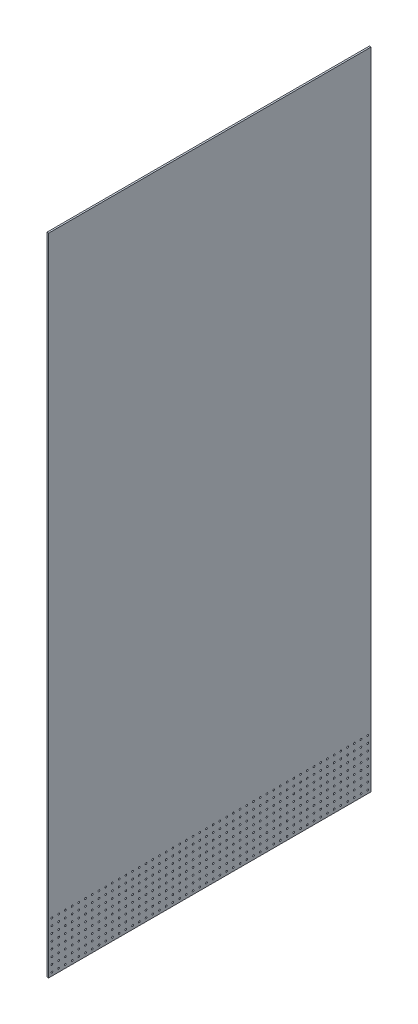
from build123d import *

# Parameters (mm, degrees)
INITIAL_HOLE_W      = 2438.4
INITIAL_HOLE_H      = 1219.2
INITIAL_HOLE_R      = 3.175
BOSS_EXTRUDE1_DEPTH = 6.35


with BuildPart() as part:
    # Initial hole → Boss-Extrude1 (new body)
    with BuildSketch(Plane.YZ):
        Rectangle(INITIAL_HOLE_W, INITIAL_HOLE_H)
        with Locations(Location((-1206.5, 596.9, 0), (0, 0, 270))):
            Circle(INITIAL_HOLE_R, mode=Mode.SUBTRACT)
        with Locations(Location((-1181.1, 596.9, 0), (0, 0, 270))):
            Circle(INITIAL_HOLE_R, mode=Mode.SUBTRACT)
        with Locations(Location((-1155.7, 596.9, 0), (0, 0, 270))):
            Circle(INITIAL_HOLE_R, mode=Mode.SUBTRACT)
        with Locations(Location((-1130.3, 596.9, 0), (0, 0, 270))):
            Circle(INITIAL_HOLE_R, mode=Mode.SUBTRACT)
        with Locations(Location((-1104.9, 596.9, 0), (0, 0, 270))):
            Circle(INITIAL_HOLE_R, mode=Mode.SUBTRACT)
        with Locations(Location((-1079.5, 596.9, 0), (0, 0, 270))):
            Circle(INITIAL_HOLE_R, mode=Mode.SUBTRACT)
        with Locations(Location((-1054.1, 596.9, 0), (0, 0, 270))):
            Circle(INITIAL_HOLE_R, mode=Mode.SUBTRACT)
        with Locations(Location((-1028.7, 596.9, 0), (0, 0, 270))):
            Circle(INITIAL_HOLE_R, mode=Mode.SUBTRACT)
        with Locations(Location((-1181.1, 571.5, 0), (0, 0, 270))):
            Circle(INITIAL_HOLE_R, mode=Mode.SUBTRACT)
        with Locations(Location((-1155.7, 571.5, 0), (0, 0, 270))):
            Circle(INITIAL_HOLE_R, mode=Mode.SUBTRACT)
        with Locations(Location((-1130.3, 571.5, 0), (0, 0, 270))):
            Circle(INITIAL_HOLE_R, mode=Mode.SUBTRACT)
        with Locations(Location((-1104.9, 571.5, 0), (0, 0, 270))):
            Circle(INITIAL_HOLE_R, mode=Mode.SUBTRACT)
        with Locations(Location((-1079.5, 571.5, 0), (0, 0, 270))):
            Circle(INITIAL_HOLE_R, mode=Mode.SUBTRACT)
        with Locations(Location((-1054.1, 571.5, 0), (0, 0, 270))):
            Circle(INITIAL_HOLE_R, mode=Mode.SUBTRACT)
        with Locations(Location((-1028.7, 571.5, 0), (0, 0, 270))):
            Circle(INITIAL_HOLE_R, mode=Mode.SUBTRACT)
        with Locations(Location((-1181.1, 546.1, 0), (0, 0, 270))):
            Circle(INITIAL_HOLE_R, mode=Mode.SUBTRACT)
        with Locations(Location((-1155.7, 546.1, 0), (0, 0, 270))):
            Circle(INITIAL_HOLE_R, mode=Mode.SUBTRACT)
        with Locations(Location((-1130.3, 546.1, 0), (0, 0, 270))):
            Circle(INITIAL_HOLE_R, mode=Mode.SUBTRACT)
        with Locations(Location((-1104.9, 546.1, 0), (0, 0, 270))):
            Circle(INITIAL_HOLE_R, mode=Mode.SUBTRACT)
        with Locations(Location((-1079.5, 546.1, 0), (0, 0, 270))):
            Circle(INITIAL_HOLE_R, mode=Mode.SUBTRACT)
        with Locations(Location((-1054.1, 546.1, 0), (0, 0, 270))):
            Circle(INITIAL_HOLE_R, mode=Mode.SUBTRACT)
        with Locations(Location((-1028.7, 546.1, 0), (0, 0, 270))):
            Circle(INITIAL_HOLE_R, mode=Mode.SUBTRACT)
        with Locations(Location((-1181.1, 520.7, 0), (0, 0, 270))):
            Circle(INITIAL_HOLE_R, mode=Mode.SUBTRACT)
        with Locations(Location((-1155.7, 520.7, 0), (0, 0, 270))):
            Circle(INITIAL_HOLE_R, mode=Mode.SUBTRACT)
        with Locations(Location((-1130.3, 520.7, 0), (0, 0, 270))):
            Circle(INITIAL_HOLE_R, mode=Mode.SUBTRACT)
        with Locations(Location((-1104.9, 520.7, 0), (0, 0, 270))):
            Circle(INITIAL_HOLE_R, mode=Mode.SUBTRACT)
        with Locations(Location((-1079.5, 520.7, 0), (0, 0, 270))):
            Circle(INITIAL_HOLE_R, mode=Mode.SUBTRACT)
        with Locations(Location((-1054.1, 520.7, 0), (0, 0, 270))):
            Circle(INITIAL_HOLE_R, mode=Mode.SUBTRACT)
        with Locations(Location((-1028.7, 520.7, 0), (0, 0, 270))):
            Circle(INITIAL_HOLE_R, mode=Mode.SUBTRACT)
        with Locations(Location((-1181.1, 495.3, 0), (0, 0, 270))):
            Circle(INITIAL_HOLE_R, mode=Mode.SUBTRACT)
        with Locations(Location((-1155.7, 495.3, 0), (0, 0, 270))):
            Circle(INITIAL_HOLE_R, mode=Mode.SUBTRACT)
        with Locations(Location((-1130.3, 495.3, 0), (0, 0, 270))):
            Circle(INITIAL_HOLE_R, mode=Mode.SUBTRACT)
        with Locations(Location((-1104.9, 495.3, 0), (0, 0, 270))):
            Circle(INITIAL_HOLE_R, mode=Mode.SUBTRACT)
        with Locations(Location((-1079.5, 495.3, 0), (0, 0, 270))):
            Circle(INITIAL_HOLE_R, mode=Mode.SUBTRACT)
        with Locations(Location((-1054.1, 495.3, 0), (0, 0, 270))):
            Circle(INITIAL_HOLE_R, mode=Mode.SUBTRACT)
        with Locations(Location((-1028.7, 495.3, 0), (0, 0, 270))):
            Circle(INITIAL_HOLE_R, mode=Mode.SUBTRACT)
        with Locations(Location((-1181.1, 469.9, 0), (0, 0, 270))):
            Circle(INITIAL_HOLE_R, mode=Mode.SUBTRACT)
        with Locations(Location((-1155.7, 469.9, 0), (0, 0, 270))):
            Circle(INITIAL_HOLE_R, mode=Mode.SUBTRACT)
        with Locations(Location((-1130.3, 469.9, 0), (0, 0, 270))):
            Circle(INITIAL_HOLE_R, mode=Mode.SUBTRACT)
        with Locations(Location((-1104.9, 469.9, 0), (0, 0, 270))):
            Circle(INITIAL_HOLE_R, mode=Mode.SUBTRACT)
        with Locations(Location((-1079.5, 469.9, 0), (0, 0, 270))):
            Circle(INITIAL_HOLE_R, mode=Mode.SUBTRACT)
        with Locations(Location((-1054.1, 469.9, 0), (0, 0, 270))):
            Circle(INITIAL_HOLE_R, mode=Mode.SUBTRACT)
        with Locations(Location((-1028.7, 469.9, 0), (0, 0, 270))):
            Circle(INITIAL_HOLE_R, mode=Mode.SUBTRACT)
        with Locations(Location((-1181.1, 444.5, 0), (0, 0, 270))):
            Circle(INITIAL_HOLE_R, mode=Mode.SUBTRACT)
        with Locations(Location((-1155.7, 444.5, 0), (0, 0, 270))):
            Circle(INITIAL_HOLE_R, mode=Mode.SUBTRACT)
        with Locations(Location((-1130.3, 444.5, 0), (0, 0, 270))):
            Circle(INITIAL_HOLE_R, mode=Mode.SUBTRACT)
        with Locations(Location((-1104.9, 444.5, 0), (0, 0, 270))):
            Circle(INITIAL_HOLE_R, mode=Mode.SUBTRACT)
        with Locations(Location((-1079.5, 444.5, 0), (0, 0, 270))):
            Circle(INITIAL_HOLE_R, mode=Mode.SUBTRACT)
        with Locations(Location((-1054.1, 444.5, 0), (0, 0, 270))):
            Circle(INITIAL_HOLE_R, mode=Mode.SUBTRACT)
        with Locations(Location((-1028.7, 444.5, 0), (0, 0, 270))):
            Circle(INITIAL_HOLE_R, mode=Mode.SUBTRACT)
        with Locations(Location((-1181.1, 419.1, 0), (0, 0, 270))):
            Circle(INITIAL_HOLE_R, mode=Mode.SUBTRACT)
        with Locations(Location((-1155.7, 419.1, 0), (0, 0, 270))):
            Circle(INITIAL_HOLE_R, mode=Mode.SUBTRACT)
        with Locations(Location((-1130.3, 419.1, 0), (0, 0, 270))):
            Circle(INITIAL_HOLE_R, mode=Mode.SUBTRACT)
        with Locations(Location((-1104.9, 419.1, 0), (0, 0, 270))):
            Circle(INITIAL_HOLE_R, mode=Mode.SUBTRACT)
        with Locations(Location((-1079.5, 419.1, 0), (0, 0, 270))):
            Circle(INITIAL_HOLE_R, mode=Mode.SUBTRACT)
        with Locations(Location((-1054.1, 419.1, 0), (0, 0, 270))):
            Circle(INITIAL_HOLE_R, mode=Mode.SUBTRACT)
        with Locations(Location((-1028.7, 419.1, 0), (0, 0, 270))):
            Circle(INITIAL_HOLE_R, mode=Mode.SUBTRACT)
        with Locations(Location((-1206.5, 571.5, 0), (0, 0, 270))):
            Circle(INITIAL_HOLE_R, mode=Mode.SUBTRACT)
        with Locations(Location((-1206.5, 546.1, 0), (0, 0, 270))):
            Circle(INITIAL_HOLE_R, mode=Mode.SUBTRACT)
        with Locations(Location((-1206.5, 520.7, 0), (0, 0, 270))):
            Circle(INITIAL_HOLE_R, mode=Mode.SUBTRACT)
        with Locations(Location((-1206.5, 495.3, 0), (0, 0, 270))):
            Circle(INITIAL_HOLE_R, mode=Mode.SUBTRACT)
        with Locations(Location((-1206.5, 469.9, 0), (0, 0, 270))):
            Circle(INITIAL_HOLE_R, mode=Mode.SUBTRACT)
        with Locations(Location((-1206.5, 444.5, 0), (0, 0, 270))):
            Circle(INITIAL_HOLE_R, mode=Mode.SUBTRACT)
        with Locations(Location((-1206.5, 419.1, 0), (0, 0, 270))):
            Circle(INITIAL_HOLE_R, mode=Mode.SUBTRACT)
        with Locations(Location((-1206.5, 393.7, 0), (0, 0, 270))):
            Circle(INITIAL_HOLE_R, mode=Mode.SUBTRACT)
        with Locations(Location((-1181.1, 393.7, 0), (0, 0, 270))):
            Circle(INITIAL_HOLE_R, mode=Mode.SUBTRACT)
        with Locations(Location((-1155.7, 393.7, 0), (0, 0, 270))):
            Circle(INITIAL_HOLE_R, mode=Mode.SUBTRACT)
        with Locations(Location((-1130.3, 393.7, 0), (0, 0, 270))):
            Circle(INITIAL_HOLE_R, mode=Mode.SUBTRACT)
        with Locations(Location((-1104.9, 393.7, 0), (0, 0, 270))):
            Circle(INITIAL_HOLE_R, mode=Mode.SUBTRACT)
        with Locations(Location((-1079.5, 393.7, 0), (0, 0, 270))):
            Circle(INITIAL_HOLE_R, mode=Mode.SUBTRACT)
        with Locations(Location((-1054.1, 393.7, 0), (0, 0, 270))):
            Circle(INITIAL_HOLE_R, mode=Mode.SUBTRACT)
        with Locations(Location((-1028.7, 393.7, 0), (0, 0, 270))):
            Circle(INITIAL_HOLE_R, mode=Mode.SUBTRACT)
        with Locations(Location((-1206.5, 368.3, 0), (0, 0, 270))):
            Circle(INITIAL_HOLE_R, mode=Mode.SUBTRACT)
        with Locations(Location((-1181.1, 368.3, 0), (0, 0, 270))):
            Circle(INITIAL_HOLE_R, mode=Mode.SUBTRACT)
        with Locations(Location((-1155.7, 368.3, 0), (0, 0, 270))):
            Circle(INITIAL_HOLE_R, mode=Mode.SUBTRACT)
        with Locations(Location((-1130.3, 368.3, 0), (0, 0, 270))):
            Circle(INITIAL_HOLE_R, mode=Mode.SUBTRACT)
        with Locations(Location((-1104.9, 368.3, 0), (0, 0, 270))):
            Circle(INITIAL_HOLE_R, mode=Mode.SUBTRACT)
        with Locations(Location((-1079.5, 368.3, 0), (0, 0, 270))):
            Circle(INITIAL_HOLE_R, mode=Mode.SUBTRACT)
        with Locations(Location((-1054.1, 368.3, 0), (0, 0, 270))):
            Circle(INITIAL_HOLE_R, mode=Mode.SUBTRACT)
        with Locations(Location((-1028.7, 368.3, 0), (0, 0, 270))):
            Circle(INITIAL_HOLE_R, mode=Mode.SUBTRACT)
        with Locations(Location((-1206.5, 342.9, 0), (0, 0, 270))):
            Circle(INITIAL_HOLE_R, mode=Mode.SUBTRACT)
        with Locations(Location((-1181.1, 342.9, 0), (0, 0, 270))):
            Circle(INITIAL_HOLE_R, mode=Mode.SUBTRACT)
        with Locations(Location((-1155.7, 342.9, 0), (0, 0, 270))):
            Circle(INITIAL_HOLE_R, mode=Mode.SUBTRACT)
        with Locations(Location((-1130.3, 342.9, 0), (0, 0, 270))):
            Circle(INITIAL_HOLE_R, mode=Mode.SUBTRACT)
        with Locations(Location((-1104.9, 342.9, 0), (0, 0, 270))):
            Circle(INITIAL_HOLE_R, mode=Mode.SUBTRACT)
        with Locations(Location((-1079.5, 342.9, 0), (0, 0, 270))):
            Circle(INITIAL_HOLE_R, mode=Mode.SUBTRACT)
        with Locations(Location((-1054.1, 342.9, 0), (0, 0, 270))):
            Circle(INITIAL_HOLE_R, mode=Mode.SUBTRACT)
        with Locations(Location((-1028.7, 342.9, 0), (0, 0, 270))):
            Circle(INITIAL_HOLE_R, mode=Mode.SUBTRACT)
        with Locations(Location((-1206.5, 317.5, 0), (0, 0, 270))):
            Circle(INITIAL_HOLE_R, mode=Mode.SUBTRACT)
        with Locations(Location((-1181.1, 317.5, 0), (0, 0, 270))):
            Circle(INITIAL_HOLE_R, mode=Mode.SUBTRACT)
        with Locations(Location((-1155.7, 317.5, 0), (0, 0, 270))):
            Circle(INITIAL_HOLE_R, mode=Mode.SUBTRACT)
        with Locations(Location((-1130.3, 317.5, 0), (0, 0, 270))):
            Circle(INITIAL_HOLE_R, mode=Mode.SUBTRACT)
        with Locations(Location((-1104.9, 317.5, 0), (0, 0, 270))):
            Circle(INITIAL_HOLE_R, mode=Mode.SUBTRACT)
        with Locations(Location((-1079.5, 317.5, 0), (0, 0, 270))):
            Circle(INITIAL_HOLE_R, mode=Mode.SUBTRACT)
        with Locations(Location((-1054.1, 317.5, 0), (0, 0, 270))):
            Circle(INITIAL_HOLE_R, mode=Mode.SUBTRACT)
        with Locations(Location((-1028.7, 317.5, 0), (0, 0, 270))):
            Circle(INITIAL_HOLE_R, mode=Mode.SUBTRACT)
        with Locations(Location((-1206.5, 292.1, 0), (0, 0, 270))):
            Circle(INITIAL_HOLE_R, mode=Mode.SUBTRACT)
        with Locations(Location((-1181.1, 292.1, 0), (0, 0, 270))):
            Circle(INITIAL_HOLE_R, mode=Mode.SUBTRACT)
        with Locations(Location((-1155.7, 292.1, 0), (0, 0, 270))):
            Circle(INITIAL_HOLE_R, mode=Mode.SUBTRACT)
        with Locations(Location((-1130.3, 292.1, 0), (0, 0, 270))):
            Circle(INITIAL_HOLE_R, mode=Mode.SUBTRACT)
        with Locations(Location((-1104.9, 292.1, 0), (0, 0, 270))):
            Circle(INITIAL_HOLE_R, mode=Mode.SUBTRACT)
        with Locations(Location((-1079.5, 292.1, 0), (0, 0, 270))):
            Circle(INITIAL_HOLE_R, mode=Mode.SUBTRACT)
        with Locations(Location((-1054.1, 292.1, 0), (0, 0, 270))):
            Circle(INITIAL_HOLE_R, mode=Mode.SUBTRACT)
        with Locations(Location((-1028.7, 292.1, 0), (0, 0, 270))):
            Circle(INITIAL_HOLE_R, mode=Mode.SUBTRACT)
        with Locations(Location((-1206.5, 266.7, 0), (0, 0, 270))):
            Circle(INITIAL_HOLE_R, mode=Mode.SUBTRACT)
        with Locations(Location((-1181.1, 266.7, 0), (0, 0, 270))):
            Circle(INITIAL_HOLE_R, mode=Mode.SUBTRACT)
        with Locations(Location((-1155.7, 266.7, 0), (0, 0, 270))):
            Circle(INITIAL_HOLE_R, mode=Mode.SUBTRACT)
        with Locations(Location((-1130.3, 266.7, 0), (0, 0, 270))):
            Circle(INITIAL_HOLE_R, mode=Mode.SUBTRACT)
        with Locations(Location((-1104.9, 266.7, 0), (0, 0, 270))):
            Circle(INITIAL_HOLE_R, mode=Mode.SUBTRACT)
        with Locations(Location((-1079.5, 266.7, 0), (0, 0, 270))):
            Circle(INITIAL_HOLE_R, mode=Mode.SUBTRACT)
        with Locations(Location((-1054.1, 266.7, 0), (0, 0, 270))):
            Circle(INITIAL_HOLE_R, mode=Mode.SUBTRACT)
        with Locations(Location((-1028.7, 266.7, 0), (0, 0, 270))):
            Circle(INITIAL_HOLE_R, mode=Mode.SUBTRACT)
        with Locations(Location((-1206.5, 241.3, 0), (0, 0, 270))):
            Circle(INITIAL_HOLE_R, mode=Mode.SUBTRACT)
        with Locations(Location((-1181.1, 241.3, 0), (0, 0, 270))):
            Circle(INITIAL_HOLE_R, mode=Mode.SUBTRACT)
        with Locations(Location((-1155.7, 241.3, 0), (0, 0, 270))):
            Circle(INITIAL_HOLE_R, mode=Mode.SUBTRACT)
        with Locations(Location((-1130.3, 241.3, 0), (0, 0, 270))):
            Circle(INITIAL_HOLE_R, mode=Mode.SUBTRACT)
        with Locations(Location((-1104.9, 241.3, 0), (0, 0, 270))):
            Circle(INITIAL_HOLE_R, mode=Mode.SUBTRACT)
        with Locations(Location((-1079.5, 241.3, 0), (0, 0, 270))):
            Circle(INITIAL_HOLE_R, mode=Mode.SUBTRACT)
        with Locations(Location((-1054.1, 241.3, 0), (0, 0, 270))):
            Circle(INITIAL_HOLE_R, mode=Mode.SUBTRACT)
        with Locations(Location((-1028.7, 241.3, 0), (0, 0, 270))):
            Circle(INITIAL_HOLE_R, mode=Mode.SUBTRACT)
        with Locations(Location((-1206.5, 215.9, 0), (0, 0, 270))):
            Circle(INITIAL_HOLE_R, mode=Mode.SUBTRACT)
        with Locations(Location((-1181.1, 215.9, 0), (0, 0, 270))):
            Circle(INITIAL_HOLE_R, mode=Mode.SUBTRACT)
        with Locations(Location((-1155.7, 215.9, 0), (0, 0, 270))):
            Circle(INITIAL_HOLE_R, mode=Mode.SUBTRACT)
        with Locations(Location((-1130.3, 215.9, 0), (0, 0, 270))):
            Circle(INITIAL_HOLE_R, mode=Mode.SUBTRACT)
        with Locations(Location((-1104.9, 215.9, 0), (0, 0, 270))):
            Circle(INITIAL_HOLE_R, mode=Mode.SUBTRACT)
        with Locations(Location((-1079.5, 215.9, 0), (0, 0, 270))):
            Circle(INITIAL_HOLE_R, mode=Mode.SUBTRACT)
        with Locations(Location((-1054.1, 215.9, 0), (0, 0, 270))):
            Circle(INITIAL_HOLE_R, mode=Mode.SUBTRACT)
        with Locations(Location((-1028.7, 215.9, 0), (0, 0, 270))):
            Circle(INITIAL_HOLE_R, mode=Mode.SUBTRACT)
        with Locations(Location((-1206.5, 190.5, 0), (0, 0, 270))):
            Circle(INITIAL_HOLE_R, mode=Mode.SUBTRACT)
        with Locations(Location((-1181.1, 190.5, 0), (0, 0, 270))):
            Circle(INITIAL_HOLE_R, mode=Mode.SUBTRACT)
        with Locations(Location((-1155.7, 190.5, 0), (0, 0, 270))):
            Circle(INITIAL_HOLE_R, mode=Mode.SUBTRACT)
        with Locations(Location((-1130.3, 190.5, 0), (0, 0, 270))):
            Circle(INITIAL_HOLE_R, mode=Mode.SUBTRACT)
        with Locations(Location((-1104.9, 190.5, 0), (0, 0, 270))):
            Circle(INITIAL_HOLE_R, mode=Mode.SUBTRACT)
        with Locations(Location((-1079.5, 190.5, 0), (0, 0, 270))):
            Circle(INITIAL_HOLE_R, mode=Mode.SUBTRACT)
        with Locations(Location((-1054.1, 190.5, 0), (0, 0, 270))):
            Circle(INITIAL_HOLE_R, mode=Mode.SUBTRACT)
        with Locations(Location((-1028.7, 190.5, 0), (0, 0, 270))):
            Circle(INITIAL_HOLE_R, mode=Mode.SUBTRACT)
        with Locations(Location((-1206.5, 165.1, 0), (0, 0, 270))):
            Circle(INITIAL_HOLE_R, mode=Mode.SUBTRACT)
        with Locations(Location((-1181.1, 165.1, 0), (0, 0, 270))):
            Circle(INITIAL_HOLE_R, mode=Mode.SUBTRACT)
        with Locations(Location((-1155.7, 165.1, 0), (0, 0, 270))):
            Circle(INITIAL_HOLE_R, mode=Mode.SUBTRACT)
        with Locations(Location((-1130.3, 165.1, 0), (0, 0, 270))):
            Circle(INITIAL_HOLE_R, mode=Mode.SUBTRACT)
        with Locations(Location((-1104.9, 165.1, 0), (0, 0, 270))):
            Circle(INITIAL_HOLE_R, mode=Mode.SUBTRACT)
        with Locations(Location((-1079.5, 165.1, 0), (0, 0, 270))):
            Circle(INITIAL_HOLE_R, mode=Mode.SUBTRACT)
        with Locations(Location((-1054.1, 165.1, 0), (0, 0, 270))):
            Circle(INITIAL_HOLE_R, mode=Mode.SUBTRACT)
        with Locations(Location((-1028.7, 165.1, 0), (0, 0, 270))):
            Circle(INITIAL_HOLE_R, mode=Mode.SUBTRACT)
        with Locations(Location((-1206.5, 139.7, 0), (0, 0, 270))):
            Circle(INITIAL_HOLE_R, mode=Mode.SUBTRACT)
        with Locations(Location((-1181.1, 139.7, 0), (0, 0, 270))):
            Circle(INITIAL_HOLE_R, mode=Mode.SUBTRACT)
        with Locations(Location((-1155.7, 139.7, 0), (0, 0, 270))):
            Circle(INITIAL_HOLE_R, mode=Mode.SUBTRACT)
        with Locations(Location((-1130.3, 139.7, 0), (0, 0, 270))):
            Circle(INITIAL_HOLE_R, mode=Mode.SUBTRACT)
        with Locations(Location((-1104.9, 139.7, 0), (0, 0, 270))):
            Circle(INITIAL_HOLE_R, mode=Mode.SUBTRACT)
        with Locations(Location((-1079.5, 139.7, 0), (0, 0, 270))):
            Circle(INITIAL_HOLE_R, mode=Mode.SUBTRACT)
        with Locations(Location((-1054.1, 139.7, 0), (0, 0, 270))):
            Circle(INITIAL_HOLE_R, mode=Mode.SUBTRACT)
        with Locations(Location((-1028.7, 139.7, 0), (0, 0, 270))):
            Circle(INITIAL_HOLE_R, mode=Mode.SUBTRACT)
        with Locations(Location((-1206.5, 114.3, 0), (0, 0, 270))):
            Circle(INITIAL_HOLE_R, mode=Mode.SUBTRACT)
        with Locations(Location((-1181.1, 114.3, 0), (0, 0, 270))):
            Circle(INITIAL_HOLE_R, mode=Mode.SUBTRACT)
        with Locations(Location((-1155.7, 114.3, 0), (0, 0, 270))):
            Circle(INITIAL_HOLE_R, mode=Mode.SUBTRACT)
        with Locations(Location((-1130.3, 114.3, 0), (0, 0, 270))):
            Circle(INITIAL_HOLE_R, mode=Mode.SUBTRACT)
        with Locations(Location((-1104.9, 114.3, 0), (0, 0, 270))):
            Circle(INITIAL_HOLE_R, mode=Mode.SUBTRACT)
        with Locations(Location((-1079.5, 114.3, 0), (0, 0, 270))):
            Circle(INITIAL_HOLE_R, mode=Mode.SUBTRACT)
        with Locations(Location((-1054.1, 114.3, 0), (0, 0, 270))):
            Circle(INITIAL_HOLE_R, mode=Mode.SUBTRACT)
        with Locations(Location((-1028.7, 114.3, 0), (0, 0, 270))):
            Circle(INITIAL_HOLE_R, mode=Mode.SUBTRACT)
        with Locations(Location((-1206.5, 88.9, 0), (0, 0, 270))):
            Circle(INITIAL_HOLE_R, mode=Mode.SUBTRACT)
        with Locations(Location((-1181.1, 88.9, 0), (0, 0, 270))):
            Circle(INITIAL_HOLE_R, mode=Mode.SUBTRACT)
        with Locations(Location((-1155.7, 88.9, 0), (0, 0, 270))):
            Circle(INITIAL_HOLE_R, mode=Mode.SUBTRACT)
        with Locations(Location((-1130.3, 88.9, 0), (0, 0, 270))):
            Circle(INITIAL_HOLE_R, mode=Mode.SUBTRACT)
        with Locations(Location((-1104.9, 88.9, 0), (0, 0, 270))):
            Circle(INITIAL_HOLE_R, mode=Mode.SUBTRACT)
        with Locations(Location((-1079.5, 88.9, 0), (0, 0, 270))):
            Circle(INITIAL_HOLE_R, mode=Mode.SUBTRACT)
        with Locations(Location((-1054.1, 88.9, 0), (0, 0, 270))):
            Circle(INITIAL_HOLE_R, mode=Mode.SUBTRACT)
        with Locations(Location((-1028.7, 88.9, 0), (0, 0, 270))):
            Circle(INITIAL_HOLE_R, mode=Mode.SUBTRACT)
        with Locations(Location((-1206.5, 63.5, 0), (0, 0, 270))):
            Circle(INITIAL_HOLE_R, mode=Mode.SUBTRACT)
        with Locations(Location((-1181.1, 63.5, 0), (0, 0, 270))):
            Circle(INITIAL_HOLE_R, mode=Mode.SUBTRACT)
        with Locations(Location((-1155.7, 63.5, 0), (0, 0, 270))):
            Circle(INITIAL_HOLE_R, mode=Mode.SUBTRACT)
        with Locations(Location((-1130.3, 63.5, 0), (0, 0, 270))):
            Circle(INITIAL_HOLE_R, mode=Mode.SUBTRACT)
        with Locations(Location((-1104.9, 63.5, 0), (0, 0, 270))):
            Circle(INITIAL_HOLE_R, mode=Mode.SUBTRACT)
        with Locations(Location((-1079.5, 63.5, 0), (0, 0, 270))):
            Circle(INITIAL_HOLE_R, mode=Mode.SUBTRACT)
        with Locations(Location((-1054.1, 63.5, 0), (0, 0, 270))):
            Circle(INITIAL_HOLE_R, mode=Mode.SUBTRACT)
        with Locations(Location((-1028.7, 63.5, 0), (0, 0, 270))):
            Circle(INITIAL_HOLE_R, mode=Mode.SUBTRACT)
        with Locations(Location((-1206.5, 38.1, 0), (0, 0, 270))):
            Circle(INITIAL_HOLE_R, mode=Mode.SUBTRACT)
        with Locations(Location((-1181.1, 38.1, 0), (0, 0, 270))):
            Circle(INITIAL_HOLE_R, mode=Mode.SUBTRACT)
        with Locations(Location((-1155.7, 38.1, 0), (0, 0, 270))):
            Circle(INITIAL_HOLE_R, mode=Mode.SUBTRACT)
        with Locations(Location((-1130.3, 38.1, 0), (0, 0, 270))):
            Circle(INITIAL_HOLE_R, mode=Mode.SUBTRACT)
        with Locations(Location((-1104.9, 38.1, 0), (0, 0, 270))):
            Circle(INITIAL_HOLE_R, mode=Mode.SUBTRACT)
        with Locations(Location((-1079.5, 38.1, 0), (0, 0, 270))):
            Circle(INITIAL_HOLE_R, mode=Mode.SUBTRACT)
        with Locations(Location((-1054.1, 38.1, 0), (0, 0, 270))):
            Circle(INITIAL_HOLE_R, mode=Mode.SUBTRACT)
        with Locations(Location((-1028.7, 38.1, 0), (0, 0, 270))):
            Circle(INITIAL_HOLE_R, mode=Mode.SUBTRACT)
        with Locations(Location((-1206.5, 12.7, 0), (0, 0, 270))):
            Circle(INITIAL_HOLE_R, mode=Mode.SUBTRACT)
        with Locations(Location((-1181.1, 12.7, 0), (0, 0, 270))):
            Circle(INITIAL_HOLE_R, mode=Mode.SUBTRACT)
        with Locations(Location((-1155.7, 12.7, 0), (0, 0, 270))):
            Circle(INITIAL_HOLE_R, mode=Mode.SUBTRACT)
        with Locations(Location((-1130.3, 12.7, 0), (0, 0, 270))):
            Circle(INITIAL_HOLE_R, mode=Mode.SUBTRACT)
        with Locations(Location((-1104.9, 12.7, 0), (0, 0, 270))):
            Circle(INITIAL_HOLE_R, mode=Mode.SUBTRACT)
        with Locations(Location((-1079.5, 12.7, 0), (0, 0, 270))):
            Circle(INITIAL_HOLE_R, mode=Mode.SUBTRACT)
        with Locations(Location((-1054.1, 12.7, 0), (0, 0, 270))):
            Circle(INITIAL_HOLE_R, mode=Mode.SUBTRACT)
        with Locations(Location((-1028.7, 12.7, 0), (0, 0, 270))):
            Circle(INITIAL_HOLE_R, mode=Mode.SUBTRACT)
        with Locations(Location((-1206.5, -12.7, 0), (0, 0, 270))):
            Circle(INITIAL_HOLE_R, mode=Mode.SUBTRACT)
        with Locations(Location((-1181.1, -12.7, 0), (0, 0, 270))):
            Circle(INITIAL_HOLE_R, mode=Mode.SUBTRACT)
        with Locations(Location((-1155.7, -12.7, 0), (0, 0, 270))):
            Circle(INITIAL_HOLE_R, mode=Mode.SUBTRACT)
        with Locations(Location((-1130.3, -12.7, 0), (0, 0, 270))):
            Circle(INITIAL_HOLE_R, mode=Mode.SUBTRACT)
        with Locations(Location((-1104.9, -12.7, 0), (0, 0, 270))):
            Circle(INITIAL_HOLE_R, mode=Mode.SUBTRACT)
        with Locations(Location((-1079.5, -12.7, 0), (0, 0, 270))):
            Circle(INITIAL_HOLE_R, mode=Mode.SUBTRACT)
        with Locations(Location((-1054.1, -12.7, 0), (0, 0, 270))):
            Circle(INITIAL_HOLE_R, mode=Mode.SUBTRACT)
        with Locations(Location((-1028.7, -12.7, 0), (0, 0, 270))):
            Circle(INITIAL_HOLE_R, mode=Mode.SUBTRACT)
        with Locations(Location((-1206.5, -38.1, 0), (0, 0, 270))):
            Circle(INITIAL_HOLE_R, mode=Mode.SUBTRACT)
        with Locations(Location((-1181.1, -38.1, 0), (0, 0, 270))):
            Circle(INITIAL_HOLE_R, mode=Mode.SUBTRACT)
        with Locations(Location((-1155.7, -38.1, 0), (0, 0, 270))):
            Circle(INITIAL_HOLE_R, mode=Mode.SUBTRACT)
        with Locations(Location((-1130.3, -38.1, 0), (0, 0, 270))):
            Circle(INITIAL_HOLE_R, mode=Mode.SUBTRACT)
        with Locations(Location((-1104.9, -38.1, 0), (0, 0, 270))):
            Circle(INITIAL_HOLE_R, mode=Mode.SUBTRACT)
        with Locations(Location((-1079.5, -38.1, 0), (0, 0, 270))):
            Circle(INITIAL_HOLE_R, mode=Mode.SUBTRACT)
        with Locations(Location((-1054.1, -38.1, 0), (0, 0, 270))):
            Circle(INITIAL_HOLE_R, mode=Mode.SUBTRACT)
        with Locations(Location((-1028.7, -38.1, 0), (0, 0, 270))):
            Circle(INITIAL_HOLE_R, mode=Mode.SUBTRACT)
        with Locations(Location((-1206.5, -63.5, 0), (0, 0, 270))):
            Circle(INITIAL_HOLE_R, mode=Mode.SUBTRACT)
        with Locations(Location((-1181.1, -63.5, 0), (0, 0, 270))):
            Circle(INITIAL_HOLE_R, mode=Mode.SUBTRACT)
        with Locations(Location((-1155.7, -63.5, 0), (0, 0, 270))):
            Circle(INITIAL_HOLE_R, mode=Mode.SUBTRACT)
        with Locations(Location((-1130.3, -63.5, 0), (0, 0, 270))):
            Circle(INITIAL_HOLE_R, mode=Mode.SUBTRACT)
        with Locations(Location((-1104.9, -63.5, 0), (0, 0, 270))):
            Circle(INITIAL_HOLE_R, mode=Mode.SUBTRACT)
        with Locations(Location((-1079.5, -63.5, 0), (0, 0, 270))):
            Circle(INITIAL_HOLE_R, mode=Mode.SUBTRACT)
        with Locations(Location((-1054.1, -63.5, 0), (0, 0, 270))):
            Circle(INITIAL_HOLE_R, mode=Mode.SUBTRACT)
        with Locations(Location((-1028.7, -63.5, 0), (0, 0, 270))):
            Circle(INITIAL_HOLE_R, mode=Mode.SUBTRACT)
        with Locations(Location((-1206.5, -88.9, 0), (0, 0, 270))):
            Circle(INITIAL_HOLE_R, mode=Mode.SUBTRACT)
        with Locations(Location((-1181.1, -88.9, 0), (0, 0, 270))):
            Circle(INITIAL_HOLE_R, mode=Mode.SUBTRACT)
        with Locations(Location((-1155.7, -88.9, 0), (0, 0, 270))):
            Circle(INITIAL_HOLE_R, mode=Mode.SUBTRACT)
        with Locations(Location((-1130.3, -88.9, 0), (0, 0, 270))):
            Circle(INITIAL_HOLE_R, mode=Mode.SUBTRACT)
        with Locations(Location((-1104.9, -88.9, 0), (0, 0, 270))):
            Circle(INITIAL_HOLE_R, mode=Mode.SUBTRACT)
        with Locations(Location((-1079.5, -88.9, 0), (0, 0, 270))):
            Circle(INITIAL_HOLE_R, mode=Mode.SUBTRACT)
        with Locations(Location((-1054.1, -88.9, 0), (0, 0, 270))):
            Circle(INITIAL_HOLE_R, mode=Mode.SUBTRACT)
        with Locations(Location((-1028.7, -88.9, 0), (0, 0, 270))):
            Circle(INITIAL_HOLE_R, mode=Mode.SUBTRACT)
        with Locations(Location((-1206.5, -114.3, 0), (0, 0, 270))):
            Circle(INITIAL_HOLE_R, mode=Mode.SUBTRACT)
        with Locations(Location((-1181.1, -114.3, 0), (0, 0, 270))):
            Circle(INITIAL_HOLE_R, mode=Mode.SUBTRACT)
        with Locations(Location((-1155.7, -114.3, 0), (0, 0, 270))):
            Circle(INITIAL_HOLE_R, mode=Mode.SUBTRACT)
        with Locations(Location((-1130.3, -114.3, 0), (0, 0, 270))):
            Circle(INITIAL_HOLE_R, mode=Mode.SUBTRACT)
        with Locations(Location((-1104.9, -114.3, 0), (0, 0, 270))):
            Circle(INITIAL_HOLE_R, mode=Mode.SUBTRACT)
        with Locations(Location((-1079.5, -114.3, 0), (0, 0, 270))):
            Circle(INITIAL_HOLE_R, mode=Mode.SUBTRACT)
        with Locations(Location((-1054.1, -114.3, 0), (0, 0, 270))):
            Circle(INITIAL_HOLE_R, mode=Mode.SUBTRACT)
        with Locations(Location((-1028.7, -114.3, 0), (0, 0, 270))):
            Circle(INITIAL_HOLE_R, mode=Mode.SUBTRACT)
        with Locations(Location((-1206.5, -139.7, 0), (0, 0, 270))):
            Circle(INITIAL_HOLE_R, mode=Mode.SUBTRACT)
        with Locations(Location((-1181.1, -139.7, 0), (0, 0, 270))):
            Circle(INITIAL_HOLE_R, mode=Mode.SUBTRACT)
        with Locations(Location((-1155.7, -139.7, 0), (0, 0, 270))):
            Circle(INITIAL_HOLE_R, mode=Mode.SUBTRACT)
        with Locations(Location((-1130.3, -139.7, 0), (0, 0, 270))):
            Circle(INITIAL_HOLE_R, mode=Mode.SUBTRACT)
        with Locations(Location((-1104.9, -139.7, 0), (0, 0, 270))):
            Circle(INITIAL_HOLE_R, mode=Mode.SUBTRACT)
        with Locations(Location((-1079.5, -139.7, 0), (0, 0, 270))):
            Circle(INITIAL_HOLE_R, mode=Mode.SUBTRACT)
        with Locations(Location((-1054.1, -139.7, 0), (0, 0, 270))):
            Circle(INITIAL_HOLE_R, mode=Mode.SUBTRACT)
        with Locations(Location((-1028.7, -139.7, 0), (0, 0, 270))):
            Circle(INITIAL_HOLE_R, mode=Mode.SUBTRACT)
        with Locations(Location((-1206.5, -165.1, 0), (0, 0, 270))):
            Circle(INITIAL_HOLE_R, mode=Mode.SUBTRACT)
        with Locations(Location((-1181.1, -165.1, 0), (0, 0, 270))):
            Circle(INITIAL_HOLE_R, mode=Mode.SUBTRACT)
        with Locations(Location((-1155.7, -165.1, 0), (0, 0, 270))):
            Circle(INITIAL_HOLE_R, mode=Mode.SUBTRACT)
        with Locations(Location((-1130.3, -165.1, 0), (0, 0, 270))):
            Circle(INITIAL_HOLE_R, mode=Mode.SUBTRACT)
        with Locations(Location((-1104.9, -165.1, 0), (0, 0, 270))):
            Circle(INITIAL_HOLE_R, mode=Mode.SUBTRACT)
        with Locations(Location((-1079.5, -165.1, 0), (0, 0, 270))):
            Circle(INITIAL_HOLE_R, mode=Mode.SUBTRACT)
        with Locations(Location((-1054.1, -165.1, 0), (0, 0, 270))):
            Circle(INITIAL_HOLE_R, mode=Mode.SUBTRACT)
        with Locations(Location((-1028.7, -165.1, 0), (0, 0, 270))):
            Circle(INITIAL_HOLE_R, mode=Mode.SUBTRACT)
        with Locations(Location((-1206.5, -190.5, 0), (0, 0, 270))):
            Circle(INITIAL_HOLE_R, mode=Mode.SUBTRACT)
        with Locations(Location((-1181.1, -190.5, 0), (0, 0, 270))):
            Circle(INITIAL_HOLE_R, mode=Mode.SUBTRACT)
        with Locations(Location((-1155.7, -190.5, 0), (0, 0, 270))):
            Circle(INITIAL_HOLE_R, mode=Mode.SUBTRACT)
        with Locations(Location((-1130.3, -190.5, 0), (0, 0, 270))):
            Circle(INITIAL_HOLE_R, mode=Mode.SUBTRACT)
        with Locations(Location((-1104.9, -190.5, 0), (0, 0, 270))):
            Circle(INITIAL_HOLE_R, mode=Mode.SUBTRACT)
        with Locations(Location((-1079.5, -190.5, 0), (0, 0, 270))):
            Circle(INITIAL_HOLE_R, mode=Mode.SUBTRACT)
        with Locations(Location((-1054.1, -190.5, 0), (0, 0, 270))):
            Circle(INITIAL_HOLE_R, mode=Mode.SUBTRACT)
        with Locations(Location((-1028.7, -190.5, 0), (0, 0, 270))):
            Circle(INITIAL_HOLE_R, mode=Mode.SUBTRACT)
        with Locations(Location((-1206.5, -215.9, 0), (0, 0, 270))):
            Circle(INITIAL_HOLE_R, mode=Mode.SUBTRACT)
        with Locations(Location((-1181.1, -215.9, 0), (0, 0, 270))):
            Circle(INITIAL_HOLE_R, mode=Mode.SUBTRACT)
        with Locations(Location((-1155.7, -215.9, 0), (0, 0, 270))):
            Circle(INITIAL_HOLE_R, mode=Mode.SUBTRACT)
        with Locations(Location((-1130.3, -215.9, 0), (0, 0, 270))):
            Circle(INITIAL_HOLE_R, mode=Mode.SUBTRACT)
        with Locations(Location((-1104.9, -215.9, 0), (0, 0, 270))):
            Circle(INITIAL_HOLE_R, mode=Mode.SUBTRACT)
        with Locations(Location((-1079.5, -215.9, 0), (0, 0, 270))):
            Circle(INITIAL_HOLE_R, mode=Mode.SUBTRACT)
        with Locations(Location((-1054.1, -215.9, 0), (0, 0, 270))):
            Circle(INITIAL_HOLE_R, mode=Mode.SUBTRACT)
        with Locations(Location((-1028.7, -215.9, 0), (0, 0, 270))):
            Circle(INITIAL_HOLE_R, mode=Mode.SUBTRACT)
        with Locations(Location((-1206.5, -241.3, 0), (0, 0, 270))):
            Circle(INITIAL_HOLE_R, mode=Mode.SUBTRACT)
        with Locations(Location((-1181.1, -241.3, 0), (0, 0, 270))):
            Circle(INITIAL_HOLE_R, mode=Mode.SUBTRACT)
        with Locations(Location((-1155.7, -241.3, 0), (0, 0, 270))):
            Circle(INITIAL_HOLE_R, mode=Mode.SUBTRACT)
        with Locations(Location((-1130.3, -241.3, 0), (0, 0, 270))):
            Circle(INITIAL_HOLE_R, mode=Mode.SUBTRACT)
        with Locations(Location((-1104.9, -241.3, 0), (0, 0, 270))):
            Circle(INITIAL_HOLE_R, mode=Mode.SUBTRACT)
        with Locations(Location((-1079.5, -241.3, 0), (0, 0, 270))):
            Circle(INITIAL_HOLE_R, mode=Mode.SUBTRACT)
        with Locations(Location((-1054.1, -241.3, 0), (0, 0, 270))):
            Circle(INITIAL_HOLE_R, mode=Mode.SUBTRACT)
        with Locations(Location((-1028.7, -241.3, 0), (0, 0, 270))):
            Circle(INITIAL_HOLE_R, mode=Mode.SUBTRACT)
        with Locations(Location((-1206.5, -266.7, 0), (0, 0, 270))):
            Circle(INITIAL_HOLE_R, mode=Mode.SUBTRACT)
        with Locations(Location((-1181.1, -266.7, 0), (0, 0, 270))):
            Circle(INITIAL_HOLE_R, mode=Mode.SUBTRACT)
        with Locations(Location((-1155.7, -266.7, 0), (0, 0, 270))):
            Circle(INITIAL_HOLE_R, mode=Mode.SUBTRACT)
        with Locations(Location((-1130.3, -266.7, 0), (0, 0, 270))):
            Circle(INITIAL_HOLE_R, mode=Mode.SUBTRACT)
        with Locations(Location((-1104.9, -266.7, 0), (0, 0, 270))):
            Circle(INITIAL_HOLE_R, mode=Mode.SUBTRACT)
        with Locations(Location((-1079.5, -266.7, 0), (0, 0, 270))):
            Circle(INITIAL_HOLE_R, mode=Mode.SUBTRACT)
        with Locations(Location((-1054.1, -266.7, 0), (0, 0, 270))):
            Circle(INITIAL_HOLE_R, mode=Mode.SUBTRACT)
        with Locations(Location((-1028.7, -266.7, 0), (0, 0, 270))):
            Circle(INITIAL_HOLE_R, mode=Mode.SUBTRACT)
        with Locations(Location((-1206.5, -292.1, 0), (0, 0, 270))):
            Circle(INITIAL_HOLE_R, mode=Mode.SUBTRACT)
        with Locations(Location((-1181.1, -292.1, 0), (0, 0, 270))):
            Circle(INITIAL_HOLE_R, mode=Mode.SUBTRACT)
        with Locations(Location((-1155.7, -292.1, 0), (0, 0, 270))):
            Circle(INITIAL_HOLE_R, mode=Mode.SUBTRACT)
        with Locations(Location((-1130.3, -292.1, 0), (0, 0, 270))):
            Circle(INITIAL_HOLE_R, mode=Mode.SUBTRACT)
        with Locations(Location((-1104.9, -292.1, 0), (0, 0, 270))):
            Circle(INITIAL_HOLE_R, mode=Mode.SUBTRACT)
        with Locations(Location((-1079.5, -292.1, 0), (0, 0, 270))):
            Circle(INITIAL_HOLE_R, mode=Mode.SUBTRACT)
        with Locations(Location((-1054.1, -292.1, 0), (0, 0, 270))):
            Circle(INITIAL_HOLE_R, mode=Mode.SUBTRACT)
        with Locations(Location((-1028.7, -292.1, 0), (0, 0, 270))):
            Circle(INITIAL_HOLE_R, mode=Mode.SUBTRACT)
        with Locations(Location((-1206.5, -317.5, 0), (0, 0, 270))):
            Circle(INITIAL_HOLE_R, mode=Mode.SUBTRACT)
        with Locations(Location((-1181.1, -317.5, 0), (0, 0, 270))):
            Circle(INITIAL_HOLE_R, mode=Mode.SUBTRACT)
        with Locations(Location((-1155.7, -317.5, 0), (0, 0, 270))):
            Circle(INITIAL_HOLE_R, mode=Mode.SUBTRACT)
        with Locations(Location((-1130.3, -317.5, 0), (0, 0, 270))):
            Circle(INITIAL_HOLE_R, mode=Mode.SUBTRACT)
        with Locations(Location((-1104.9, -317.5, 0), (0, 0, 270))):
            Circle(INITIAL_HOLE_R, mode=Mode.SUBTRACT)
        with Locations(Location((-1079.5, -317.5, 0), (0, 0, 270))):
            Circle(INITIAL_HOLE_R, mode=Mode.SUBTRACT)
        with Locations(Location((-1054.1, -317.5, 0), (0, 0, 270))):
            Circle(INITIAL_HOLE_R, mode=Mode.SUBTRACT)
        with Locations(Location((-1028.7, -317.5, 0), (0, 0, 270))):
            Circle(INITIAL_HOLE_R, mode=Mode.SUBTRACT)
        with Locations(Location((-1206.5, -342.9, 0), (0, 0, 270))):
            Circle(INITIAL_HOLE_R, mode=Mode.SUBTRACT)
        with Locations(Location((-1181.1, -342.9, 0), (0, 0, 270))):
            Circle(INITIAL_HOLE_R, mode=Mode.SUBTRACT)
        with Locations(Location((-1155.7, -342.9, 0), (0, 0, 270))):
            Circle(INITIAL_HOLE_R, mode=Mode.SUBTRACT)
        with Locations(Location((-1130.3, -342.9, 0), (0, 0, 270))):
            Circle(INITIAL_HOLE_R, mode=Mode.SUBTRACT)
        with Locations(Location((-1104.9, -342.9, 0), (0, 0, 270))):
            Circle(INITIAL_HOLE_R, mode=Mode.SUBTRACT)
        with Locations(Location((-1079.5, -342.9, 0), (0, 0, 270))):
            Circle(INITIAL_HOLE_R, mode=Mode.SUBTRACT)
        with Locations(Location((-1054.1, -342.9, 0), (0, 0, 270))):
            Circle(INITIAL_HOLE_R, mode=Mode.SUBTRACT)
        with Locations(Location((-1028.7, -342.9, 0), (0, 0, 270))):
            Circle(INITIAL_HOLE_R, mode=Mode.SUBTRACT)
        with Locations(Location((-1206.5, -368.3, 0), (0, 0, 270))):
            Circle(INITIAL_HOLE_R, mode=Mode.SUBTRACT)
        with Locations(Location((-1181.1, -368.3, 0), (0, 0, 270))):
            Circle(INITIAL_HOLE_R, mode=Mode.SUBTRACT)
        with Locations(Location((-1155.7, -368.3, 0), (0, 0, 270))):
            Circle(INITIAL_HOLE_R, mode=Mode.SUBTRACT)
        with Locations(Location((-1130.3, -368.3, 0), (0, 0, 270))):
            Circle(INITIAL_HOLE_R, mode=Mode.SUBTRACT)
        with Locations(Location((-1104.9, -368.3, 0), (0, 0, 270))):
            Circle(INITIAL_HOLE_R, mode=Mode.SUBTRACT)
        with Locations(Location((-1079.5, -368.3, 0), (0, 0, 270))):
            Circle(INITIAL_HOLE_R, mode=Mode.SUBTRACT)
        with Locations(Location((-1054.1, -368.3, 0), (0, 0, 270))):
            Circle(INITIAL_HOLE_R, mode=Mode.SUBTRACT)
        with Locations(Location((-1028.7, -368.3, 0), (0, 0, 270))):
            Circle(INITIAL_HOLE_R, mode=Mode.SUBTRACT)
        with Locations(Location((-1206.5, -393.7, 0), (0, 0, 270))):
            Circle(INITIAL_HOLE_R, mode=Mode.SUBTRACT)
        with Locations(Location((-1181.1, -393.7, 0), (0, 0, 270))):
            Circle(INITIAL_HOLE_R, mode=Mode.SUBTRACT)
        with Locations(Location((-1155.7, -393.7, 0), (0, 0, 270))):
            Circle(INITIAL_HOLE_R, mode=Mode.SUBTRACT)
        with Locations(Location((-1130.3, -393.7, 0), (0, 0, 270))):
            Circle(INITIAL_HOLE_R, mode=Mode.SUBTRACT)
        with Locations(Location((-1104.9, -393.7, 0), (0, 0, 270))):
            Circle(INITIAL_HOLE_R, mode=Mode.SUBTRACT)
        with Locations(Location((-1079.5, -393.7, 0), (0, 0, 270))):
            Circle(INITIAL_HOLE_R, mode=Mode.SUBTRACT)
        with Locations(Location((-1054.1, -393.7, 0), (0, 0, 270))):
            Circle(INITIAL_HOLE_R, mode=Mode.SUBTRACT)
        with Locations(Location((-1028.7, -393.7, 0), (0, 0, 270))):
            Circle(INITIAL_HOLE_R, mode=Mode.SUBTRACT)
        with Locations(Location((-1206.5, -419.1, 0), (0, 0, 270))):
            Circle(INITIAL_HOLE_R, mode=Mode.SUBTRACT)
        with Locations(Location((-1181.1, -419.1, 0), (0, 0, 270))):
            Circle(INITIAL_HOLE_R, mode=Mode.SUBTRACT)
        with Locations(Location((-1155.7, -419.1, 0), (0, 0, 270))):
            Circle(INITIAL_HOLE_R, mode=Mode.SUBTRACT)
        with Locations(Location((-1130.3, -419.1, 0), (0, 0, 270))):
            Circle(INITIAL_HOLE_R, mode=Mode.SUBTRACT)
        with Locations(Location((-1104.9, -419.1, 0), (0, 0, 270))):
            Circle(INITIAL_HOLE_R, mode=Mode.SUBTRACT)
        with Locations(Location((-1079.5, -419.1, 0), (0, 0, 270))):
            Circle(INITIAL_HOLE_R, mode=Mode.SUBTRACT)
        with Locations(Location((-1054.1, -419.1, 0), (0, 0, 270))):
            Circle(INITIAL_HOLE_R, mode=Mode.SUBTRACT)
        with Locations(Location((-1028.7, -419.1, 0), (0, 0, 270))):
            Circle(INITIAL_HOLE_R, mode=Mode.SUBTRACT)
        with Locations(Location((-1206.5, -444.5, 0), (0, 0, 270))):
            Circle(INITIAL_HOLE_R, mode=Mode.SUBTRACT)
        with Locations(Location((-1181.1, -444.5, 0), (0, 0, 270))):
            Circle(INITIAL_HOLE_R, mode=Mode.SUBTRACT)
        with Locations(Location((-1155.7, -444.5, 0), (0, 0, 270))):
            Circle(INITIAL_HOLE_R, mode=Mode.SUBTRACT)
        with Locations(Location((-1130.3, -444.5, 0), (0, 0, 270))):
            Circle(INITIAL_HOLE_R, mode=Mode.SUBTRACT)
        with Locations(Location((-1104.9, -444.5, 0), (0, 0, 270))):
            Circle(INITIAL_HOLE_R, mode=Mode.SUBTRACT)
        with Locations(Location((-1079.5, -444.5, 0), (0, 0, 270))):
            Circle(INITIAL_HOLE_R, mode=Mode.SUBTRACT)
        with Locations(Location((-1054.1, -444.5, 0), (0, 0, 270))):
            Circle(INITIAL_HOLE_R, mode=Mode.SUBTRACT)
        with Locations(Location((-1028.7, -444.5, 0), (0, 0, 270))):
            Circle(INITIAL_HOLE_R, mode=Mode.SUBTRACT)
        with Locations(Location((-1206.5, -469.9, 0), (0, 0, 270))):
            Circle(INITIAL_HOLE_R, mode=Mode.SUBTRACT)
        with Locations(Location((-1181.1, -469.9, 0), (0, 0, 270))):
            Circle(INITIAL_HOLE_R, mode=Mode.SUBTRACT)
        with Locations(Location((-1155.7, -469.9, 0), (0, 0, 270))):
            Circle(INITIAL_HOLE_R, mode=Mode.SUBTRACT)
        with Locations(Location((-1130.3, -469.9, 0), (0, 0, 270))):
            Circle(INITIAL_HOLE_R, mode=Mode.SUBTRACT)
        with Locations(Location((-1104.9, -469.9, 0), (0, 0, 270))):
            Circle(INITIAL_HOLE_R, mode=Mode.SUBTRACT)
        with Locations(Location((-1079.5, -469.9, 0), (0, 0, 270))):
            Circle(INITIAL_HOLE_R, mode=Mode.SUBTRACT)
        with Locations(Location((-1054.1, -469.9, 0), (0, 0, 270))):
            Circle(INITIAL_HOLE_R, mode=Mode.SUBTRACT)
        with Locations(Location((-1028.7, -469.9, 0), (0, 0, 270))):
            Circle(INITIAL_HOLE_R, mode=Mode.SUBTRACT)
        with Locations(Location((-1206.5, -495.3, 0), (0, 0, 270))):
            Circle(INITIAL_HOLE_R, mode=Mode.SUBTRACT)
        with Locations(Location((-1181.1, -495.3, 0), (0, 0, 270))):
            Circle(INITIAL_HOLE_R, mode=Mode.SUBTRACT)
        with Locations(Location((-1155.7, -495.3, 0), (0, 0, 270))):
            Circle(INITIAL_HOLE_R, mode=Mode.SUBTRACT)
        with Locations(Location((-1130.3, -495.3, 0), (0, 0, 270))):
            Circle(INITIAL_HOLE_R, mode=Mode.SUBTRACT)
        with Locations(Location((-1104.9, -495.3, 0), (0, 0, 270))):
            Circle(INITIAL_HOLE_R, mode=Mode.SUBTRACT)
        with Locations(Location((-1079.5, -495.3, 0), (0, 0, 270))):
            Circle(INITIAL_HOLE_R, mode=Mode.SUBTRACT)
        with Locations(Location((-1054.1, -495.3, 0), (0, 0, 270))):
            Circle(INITIAL_HOLE_R, mode=Mode.SUBTRACT)
        with Locations(Location((-1028.7, -495.3, 0), (0, 0, 270))):
            Circle(INITIAL_HOLE_R, mode=Mode.SUBTRACT)
        with Locations(Location((-1206.5, -520.7, 0), (0, 0, 270))):
            Circle(INITIAL_HOLE_R, mode=Mode.SUBTRACT)
        with Locations(Location((-1181.1, -520.7, 0), (0, 0, 270))):
            Circle(INITIAL_HOLE_R, mode=Mode.SUBTRACT)
        with Locations(Location((-1155.7, -520.7, 0), (0, 0, 270))):
            Circle(INITIAL_HOLE_R, mode=Mode.SUBTRACT)
        with Locations(Location((-1130.3, -520.7, 0), (0, 0, 270))):
            Circle(INITIAL_HOLE_R, mode=Mode.SUBTRACT)
        with Locations(Location((-1104.9, -520.7, 0), (0, 0, 270))):
            Circle(INITIAL_HOLE_R, mode=Mode.SUBTRACT)
        with Locations(Location((-1079.5, -520.7, 0), (0, 0, 270))):
            Circle(INITIAL_HOLE_R, mode=Mode.SUBTRACT)
        with Locations(Location((-1054.1, -520.7, 0), (0, 0, 270))):
            Circle(INITIAL_HOLE_R, mode=Mode.SUBTRACT)
        with Locations(Location((-1028.7, -520.7, 0), (0, 0, 270))):
            Circle(INITIAL_HOLE_R, mode=Mode.SUBTRACT)
        with Locations(Location((-1206.5, -546.1, 0), (0, 0, 270))):
            Circle(INITIAL_HOLE_R, mode=Mode.SUBTRACT)
        with Locations(Location((-1181.1, -546.1, 0), (0, 0, 270))):
            Circle(INITIAL_HOLE_R, mode=Mode.SUBTRACT)
        with Locations(Location((-1155.7, -546.1, 0), (0, 0, 270))):
            Circle(INITIAL_HOLE_R, mode=Mode.SUBTRACT)
        with Locations(Location((-1130.3, -546.1, 0), (0, 0, 270))):
            Circle(INITIAL_HOLE_R, mode=Mode.SUBTRACT)
        with Locations(Location((-1104.9, -546.1, 0), (0, 0, 270))):
            Circle(INITIAL_HOLE_R, mode=Mode.SUBTRACT)
        with Locations(Location((-1079.5, -546.1, 0), (0, 0, 270))):
            Circle(INITIAL_HOLE_R, mode=Mode.SUBTRACT)
        with Locations(Location((-1054.1, -546.1, 0), (0, 0, 270))):
            Circle(INITIAL_HOLE_R, mode=Mode.SUBTRACT)
        with Locations(Location((-1028.7, -546.1, 0), (0, 0, 270))):
            Circle(INITIAL_HOLE_R, mode=Mode.SUBTRACT)
        with Locations(Location((-1206.5, -571.5, 0), (0, 0, 270))):
            Circle(INITIAL_HOLE_R, mode=Mode.SUBTRACT)
        with Locations(Location((-1181.1, -571.5, 0), (0, 0, 270))):
            Circle(INITIAL_HOLE_R, mode=Mode.SUBTRACT)
        with Locations(Location((-1155.7, -571.5, 0), (0, 0, 270))):
            Circle(INITIAL_HOLE_R, mode=Mode.SUBTRACT)
        with Locations(Location((-1130.3, -571.5, 0), (0, 0, 270))):
            Circle(INITIAL_HOLE_R, mode=Mode.SUBTRACT)
        with Locations(Location((-1104.9, -571.5, 0), (0, 0, 270))):
            Circle(INITIAL_HOLE_R, mode=Mode.SUBTRACT)
        with Locations(Location((-1079.5, -571.5, 0), (0, 0, 270))):
            Circle(INITIAL_HOLE_R, mode=Mode.SUBTRACT)
        with Locations(Location((-1054.1, -571.5, 0), (0, 0, 270))):
            Circle(INITIAL_HOLE_R, mode=Mode.SUBTRACT)
        with Locations(Location((-1028.7, -571.5, 0), (0, 0, 270))):
            Circle(INITIAL_HOLE_R, mode=Mode.SUBTRACT)
        with Locations(Location((-1206.5, -596.9, 0), (0, 0, 270))):
            Circle(INITIAL_HOLE_R, mode=Mode.SUBTRACT)
        with Locations(Location((-1181.1, -596.9, 0), (0, 0, 270))):
            Circle(INITIAL_HOLE_R, mode=Mode.SUBTRACT)
        with Locations(Location((-1155.7, -596.9, 0), (0, 0, 270))):
            Circle(INITIAL_HOLE_R, mode=Mode.SUBTRACT)
        with Locations(Location((-1130.3, -596.9, 0), (0, 0, 270))):
            Circle(INITIAL_HOLE_R, mode=Mode.SUBTRACT)
        with Locations(Location((-1104.9, -596.9, 0), (0, 0, 270))):
            Circle(INITIAL_HOLE_R, mode=Mode.SUBTRACT)
        with Locations(Location((-1079.5, -596.9, 0), (0, 0, 270))):
            Circle(INITIAL_HOLE_R, mode=Mode.SUBTRACT)
        with Locations(Location((-1054.1, -596.9, 0), (0, 0, 270))):
            Circle(INITIAL_HOLE_R, mode=Mode.SUBTRACT)
        with Locations(Location((-1028.7, -596.9, 0), (0, 0, 270))):
            Circle(INITIAL_HOLE_R, mode=Mode.SUBTRACT)
    extrude(amount=BOSS_EXTRUDE1_DEPTH)


solid = part.part
